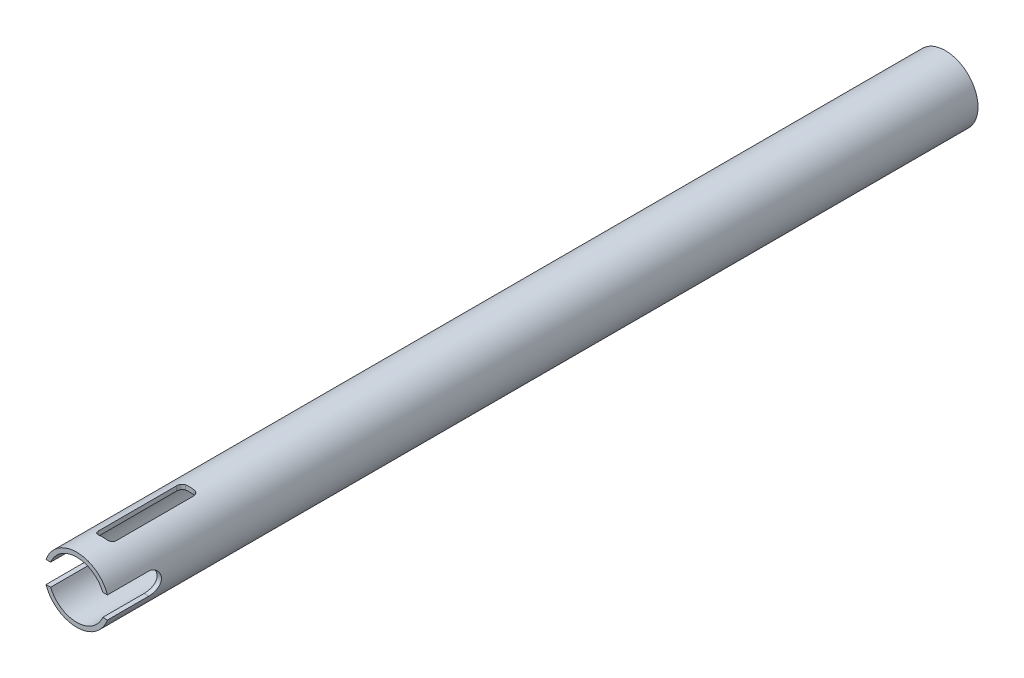
from build123d import *

# Parameters (mm, degrees)
SKETCH1_R               = 4.7625
SKETCH1_R_2             = 4.1275
SHAFTBODY_DEPTH         = 127
SIDECUTS_DEPTH          = 128.178468353
SIDECUTS_DEPTH_BACK     = 128.178468353
CUT_EXTRUDE2_REACH      = 129.178
CUT_EXTRUDE2_END_RADIUS = 4.7625


with BuildPart() as part:
    # Sketch1 → ShaftBody (new body)
    with BuildSketch(Plane.XY):
        Circle(SKETCH1_R)
        Circle(SKETCH1_R_2, mode=Mode.SUBTRACT)
    extrude(amount=-SHAFTBODY_DEPTH)

    # Sketch6 → SideCuts (cut, two sides: drawn at the far end of the back side and taken through both)
    with BuildSketch(Plane(origin=(0, 0, 0), x_dir=(0, 0, -1), z_dir=(1, 0, 0)).offset(-SIDECUTS_DEPTH_BACK)):
        with BuildLine():
            Line((6.0325, 1.5875), (0, 1.5875))
            Line((0, 1.5875), (0, -1.5875))
            Line((0, -1.5875), (6.0325, -1.5875))
            ThreePointArc((6.0325, -1.5875), (7.62, 0), (6.0325, 1.5875))
        make_face()
    extrude(amount=SIDECUTS_DEPTH + SIDECUTS_DEPTH_BACK, mode=Mode.SUBTRACT)

    # Cut-Extrude2: up to this cylinder (the profile starts inside it)
    cut_extrude2_end = Plane(origin=(0, 0, -10.16), z_dir=(0, 0, 1)) * Cylinder(CUT_EXTRUDE2_END_RADIUS, 268.881, mode=Mode.PRIVATE)
    # Sketch7 → Cut-Extrude2 (cut, up to the surface)
    with BuildSketch(Plane(origin=(0, 0, 0), x_dir=(1, 0, 0), z_dir=(0, 1, 0)), mode=Mode.PRIVATE) as cut_extrude2_sk1:
        with BuildLine():
            Line((-0.635, 3.81), (0.635, 3.81))
            ThreePointArc((0.635, 3.81), (1.084012806, 3.995987194), (1.27, 4.445))
            Line((1.27, 4.445), (1.27, 15.875))
            ThreePointArc((1.27, 15.875), (1.084012806, 16.324012806), (0.635, 16.51))
            Line((0.635, 16.51), (-0.635, 16.51))
            ThreePointArc((-0.635, 16.51), (-1.084012806, 16.324012806), (-1.27, 15.875))
            Line((-1.27, 15.875), (-1.27, 4.445))
            ThreePointArc((-1.27, 4.445), (-1.084012806, 3.995987194), (-0.635, 3.81))
        make_face()
    cut_extrude2_tool1 = extrude(cut_extrude2_sk1.sketch, amount=CUT_EXTRUDE2_REACH, mode=Mode.PRIVATE) & cut_extrude2_end
    add(cut_extrude2_tool1.solids().sort_by_distance((0, 0, -10.16))[0], mode=Mode.SUBTRACT)


solid = part.part
